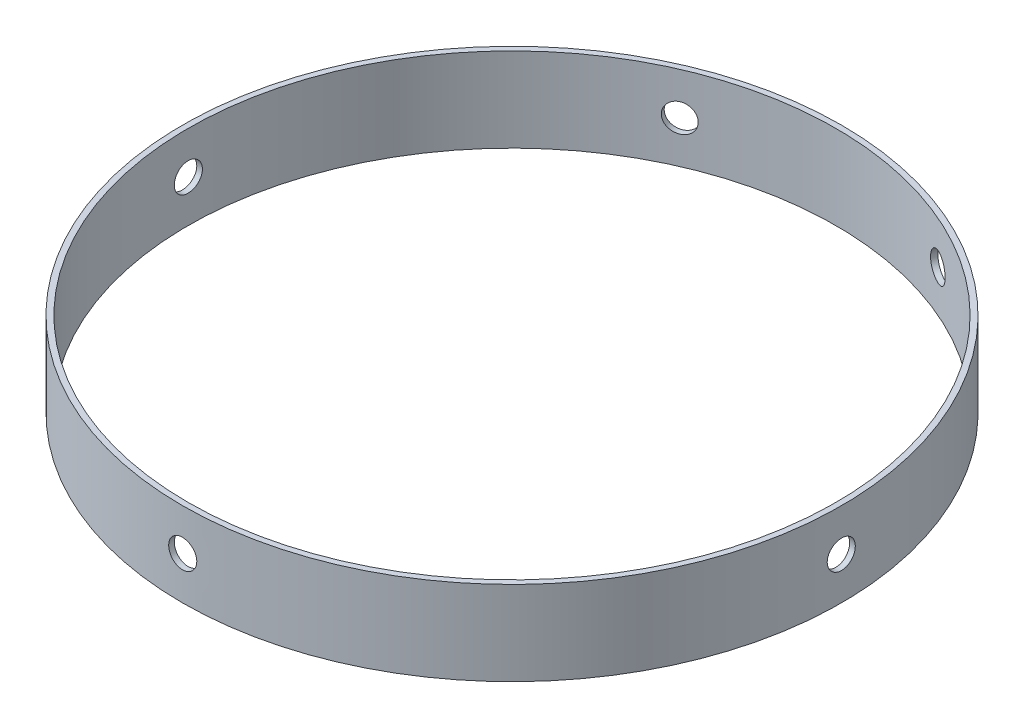
from build123d import *

# Parameters (mm, degrees)
SKETCH1_R                                 = 74.5363
SKETCH1_R_2                               = 73.2663
BOSS_EXTRUDE1_DEPTH                       = 19.05
F_1_4_0_25_DIAMETER_HOLE1_REACH           = 179.139
F_1_4_0_25_DIAMETER_HOLE1_BORE_R          = 3.175
F_1_4_0_25_DIAMETER_HOLE1_ON_FACE_2_REACH = 179.139
F_1_4_0_25_DIAMETER_HOLE1_BORE_2_R        = 3.175
F_1_4_0_25_DIAMETER_HOLE4_REACH           = 168.94
F_1_4_0_25_DIAMETER_HOLE4_BORE_R          = 3.175
F_1_4_0_25_DIAMETER_HOLE4_ON_FACE_2_REACH = 168.949
F_1_4_0_25_DIAMETER_HOLE4_BORE_2_R        = 3.175
F_1_4_0_25_DIAMETER_HOLE4_ON_FACE_3_REACH = 168.94
F_1_4_0_25_DIAMETER_HOLE4_BORE_3_R        = 3.175


with BuildPart() as part:
    # Sketch1 → Boss-Extrude1 (new body)
    with BuildSketch(Plane(origin=(0, 0, 0), x_dir=(1, 0, 0), z_dir=(0, 1, 0))):
        with Locations(Location((0, 0, 0), (0, 0, 90))):
            Circle(SKETCH1_R)
        with Locations(Location((0, 0, 0), (0, 0, 90))):
            Circle(SKETCH1_R_2, mode=Mode.SUBTRACT)
    extrude(amount=BOSS_EXTRUDE1_DEPTH)

    # 1/4 (0.25) Diameter Hole1 bore (on position points) → 1/4 (0.25) Diameter Hole1 (cut, up to next)
    with BuildSketch(Plane(origin=(-29.721280226, 9.525, -68.354264822), x_dir=(-0.917060074385, 0, 0.398749068925), z_dir=(-0.398749068925, 0, -0.917060074385)), mode=Mode.PRIVATE) as f_1_4_0_25_diameter_hole1_sk1:
        Circle(F_1_4_0_25_DIAMETER_HOLE1_BORE_R)
    f_1_4_0_25_diameter_hole1_tool1 = extrude(f_1_4_0_25_diameter_hole1_sk1.sketch, amount=-F_1_4_0_25_DIAMETER_HOLE1_REACH, mode=Mode.PRIVATE) & part.part
    add(f_1_4_0_25_diameter_hole1_tool1.solids().sort_by_distance((-29.72128, 9.525, -68.354265))[0], mode=Mode.SUBTRACT)

    # 1/4 (0.25) Diameter Hole1 bore 2 (on position points) → 1/4 (0.25) Diameter Hole1 on face 2 (cut, up to next)
    with BuildSketch(Plane(origin=(29.721280226, 9.525, -68.354264822), x_dir=(-0.917060087762, 0, -0.39874903816), z_dir=(0.39874903816, 0, -0.917060087762)), mode=Mode.PRIVATE) as f_1_4_0_25_diameter_hole1_on_face_2_sk1:
        Circle(F_1_4_0_25_DIAMETER_HOLE1_BORE_2_R)
    f_1_4_0_25_diameter_hole1_on_face_2_tool1 = extrude(f_1_4_0_25_diameter_hole1_on_face_2_sk1.sketch, amount=-F_1_4_0_25_DIAMETER_HOLE1_ON_FACE_2_REACH, mode=Mode.PRIVATE) & part.part
    add(f_1_4_0_25_diameter_hole1_on_face_2_tool1.solids().sort_by_distance((29.72128, 9.525, -68.354265))[0], mode=Mode.SUBTRACT)

    # 1/4 (0.25) Diameter Hole4 bore (on position points) → 1/4 (0.25) Diameter Hole4 (cut, up to next)
    with BuildSketch(Plane(origin=(74.5363, 9.525, 0), x_dir=(0, 0, 1), z_dir=(1, 0, 0)), mode=Mode.PRIVATE) as f_1_4_0_25_diameter_hole4_sk1:
        Circle(F_1_4_0_25_DIAMETER_HOLE4_BORE_R)
    f_1_4_0_25_diameter_hole4_tool1 = extrude(f_1_4_0_25_diameter_hole4_sk1.sketch, amount=-F_1_4_0_25_DIAMETER_HOLE4_REACH, mode=Mode.PRIVATE) & part.part
    add(f_1_4_0_25_diameter_hole4_tool1.solids().sort_by_distance((74.5363, 9.525, 0))[0], mode=Mode.SUBTRACT)

    # 1/4 (0.25) Diameter Hole4 bore 2 (on position points) → 1/4 (0.25) Diameter Hole4 on face 2 (cut, up to next)
    with BuildSketch(Plane(origin=(0, 9.674393406, 74.5363), x_dir=(1, 0, 0), z_dir=(0, 0, 1)), mode=Mode.PRIVATE) as f_1_4_0_25_diameter_hole4_on_face_2_sk1:
        Circle(F_1_4_0_25_DIAMETER_HOLE4_BORE_2_R)
    f_1_4_0_25_diameter_hole4_on_face_2_tool1 = extrude(f_1_4_0_25_diameter_hole4_on_face_2_sk1.sketch, amount=-F_1_4_0_25_DIAMETER_HOLE4_ON_FACE_2_REACH, mode=Mode.PRIVATE) & part.part
    add(f_1_4_0_25_diameter_hole4_on_face_2_tool1.solids().sort_by_distance((0, 9.674393, 74.5363))[0], mode=Mode.SUBTRACT)

    # 1/4 (0.25) Diameter Hole4 bore 3 (on position points) → 1/4 (0.25) Diameter Hole4 on face 3 (cut, up to next)
    with BuildSketch(Plane(origin=(-74.5363, 9.525, 0), x_dir=(0, 0, -1), z_dir=(-1, 0, 0)), mode=Mode.PRIVATE) as f_1_4_0_25_diameter_hole4_on_face_3_sk1:
        Circle(F_1_4_0_25_DIAMETER_HOLE4_BORE_3_R)
    f_1_4_0_25_diameter_hole4_on_face_3_tool1 = extrude(f_1_4_0_25_diameter_hole4_on_face_3_sk1.sketch, amount=-F_1_4_0_25_DIAMETER_HOLE4_ON_FACE_3_REACH, mode=Mode.PRIVATE) & part.part
    add(f_1_4_0_25_diameter_hole4_on_face_3_tool1.solids().sort_by_distance((-74.5363, 9.525, 0))[0], mode=Mode.SUBTRACT)


solid = part.part
